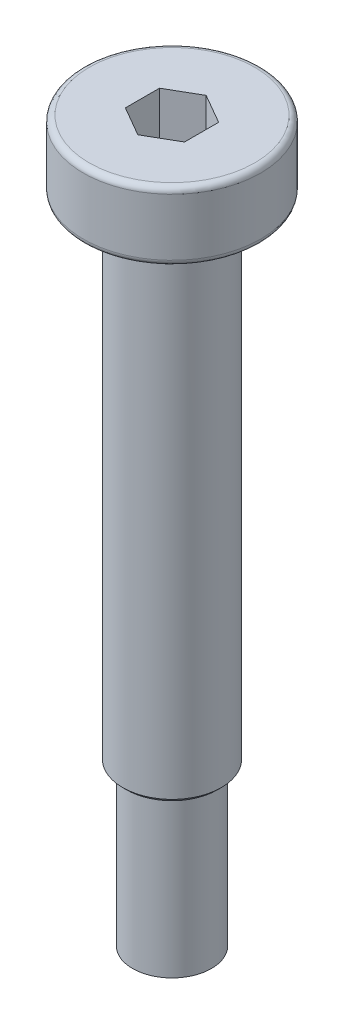
from build123d import *

# Parameters (mm, degrees)
FILLET_1_R          = 0.3
CUT_EXTRUDE_1_DEPTH = 2.4
CHAMFER_1_SIZE      = 0.2


with BuildPart() as part:
    # 草图1 → 旋转1 (revolve)
    with BuildSketch(Plane.XY):
        Polygon((0, 3.5), (-4.5, 3.5), (-4.5, 0), (-2.5, 0), (-2.5, -25), (-2, -25), (-2, -33), (0, -33), align=None)
    revolve(axis=Axis((0, 3.5, 0), (0, -1, 0)))

    # 圆角1
    fillet_1_edges = [part.edges().sort_by_distance(p)[0] for p in [
        (4.5, 0, 0),
        (4.5, 3.5, 0),
    ]]
    fillet(fillet_1_edges, radius=FILLET_1_R)

    # 草图2 → 切除-拉伸1 (cut)
    with BuildSketch(Plane(origin=(0, 3.5, 0), x_dir=(1, 0, 0), z_dir=(0, 1, 0))):
        Polygon((1.5, -0.866025404), (1.5, 0.866025404), (0, 1.732050808), (-1.5, 0.866025404), (-1.5, -0.866025404), (0, -1.732050808), align=None)
    extrude(amount=-CUT_EXTRUDE_1_DEPTH, mode=Mode.SUBTRACT)

    # 倒角1
    chamfer_1_edges = [part.edges().sort_by_distance(p)[0] for p in [
        (2.5, -25, 0),
    ]]
    chamfer(chamfer_1_edges, length=CHAMFER_1_SIZE)


solid = part.part
